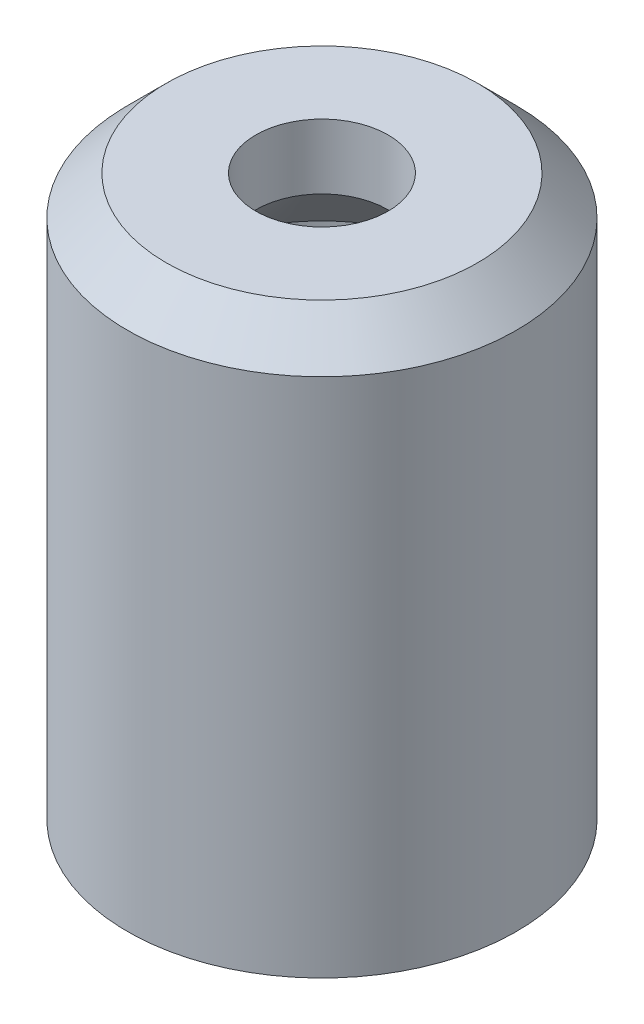
from build123d import *


with BuildPart() as part:
    # Sketch1 → Revolve1 (revolve)
    with BuildSketch(Plane.XY, mode=Mode.PRIVATE) as revolve1_sk:
        Polygon((-15, -2), (-15, 38.15), (-12, 41.15), (-5.1, 41.15), (-5.1, 36.15), (-11.25, 30), (-11.25, -2), align=None)
    revolve(revolve1_sk.sketch.rotate(Axis((0, 0, 0), (0, 1, 0)), 270), axis=Axis((0, 0, 0), (0, 1, 0)))


solid = part.part
